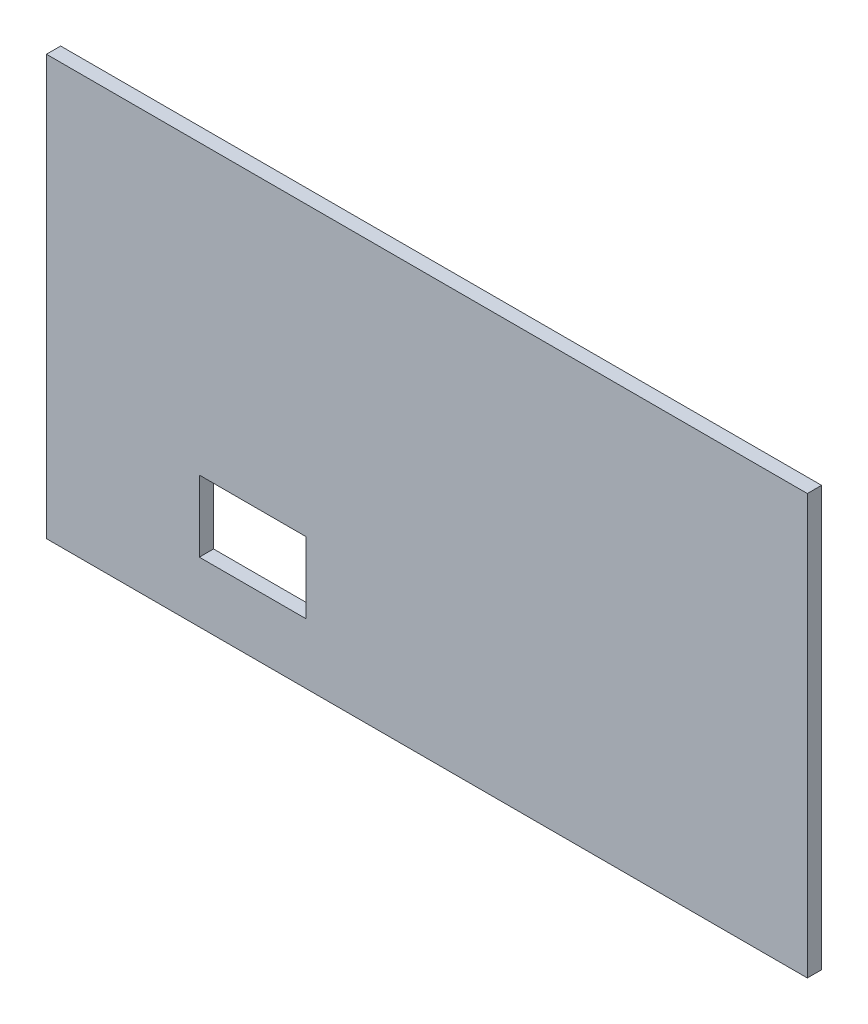
from build123d import *

# Parameters (mm, degrees)
ESBO_O1_W                = 107
ESBO_O1_H                = 59
ESBO_O1_W_2              = 15
ESBO_O1_H_2              = 10
RESSALTO_EXTRUS_O1_DEPTH = 2


with BuildPart() as part:
    # Esboço1 → Ressalto-extrusão1 (new body)
    with BuildSketch(Plane.XY):
        with Locations((53.5, 29.5)):
            Rectangle(ESBO_O1_W, ESBO_O1_H)
        with Locations((29, 13.5)):
            Rectangle(ESBO_O1_W_2, ESBO_O1_H_2, mode=Mode.SUBTRACT)
    extrude(amount=RESSALTO_EXTRUS_O1_DEPTH)


solid = part.part
